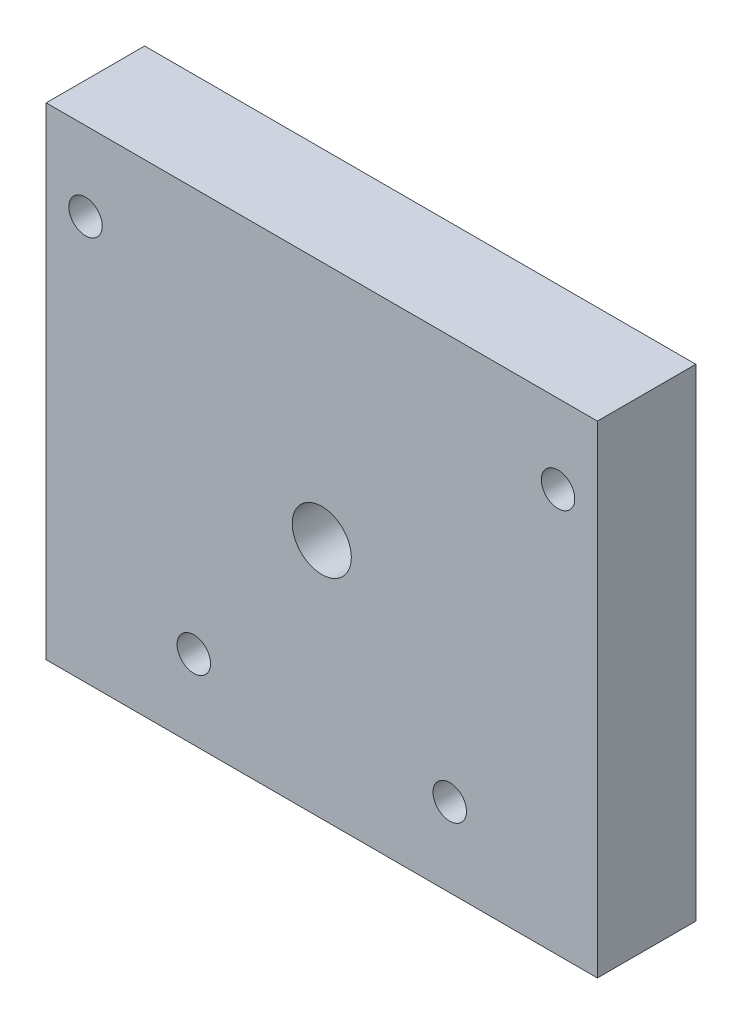
from build123d import *

# Parameters (mm, degrees)
SKETCH1_W           = 280
SKETCH1_H           = 245
SKETCH1_R           = 15
SKETCH1_R_2         = 5.25
BOSS_EXTRUDE1_DEPTH = 50
SKETCH2_R           = 8.5
CUT_EXTRUDE1_DEPTH  = 12


with BuildPart() as part:
    # Sketch1 → Boss-Extrude1 (new body)
    with BuildSketch(Plane.XY):
        Rectangle(SKETCH1_W, SKETCH1_H)
        Circle(SKETCH1_R, mode=Mode.SUBTRACT)
        with Locations((-120, 82.5)):
            Circle(SKETCH1_R_2, mode=Mode.SUBTRACT)
        with Locations((120, 82.5)):
            Circle(SKETCH1_R_2, mode=Mode.SUBTRACT)
        with Locations((-65, -82.5)):
            Circle(SKETCH1_R_2, mode=Mode.SUBTRACT)
        with Locations((65, -82.5)):
            Circle(SKETCH1_R_2, mode=Mode.SUBTRACT)
    extrude(amount=BOSS_EXTRUDE1_DEPTH)

    # Sketch2 → Cut-Extrude1 (cut)
    with BuildSketch(Plane.XY.offset(50)):
        with Locations((-120, 82.5)):
            Circle(SKETCH2_R)
        with Locations((120, 82.5)):
            Circle(SKETCH2_R)
        with Locations((65, -82.5)):
            Circle(SKETCH2_R)
        with Locations((-65, -82.5)):
            Circle(SKETCH2_R)
    extrude(amount=-CUT_EXTRUDE1_DEPTH, mode=Mode.SUBTRACT)


solid = part.part
